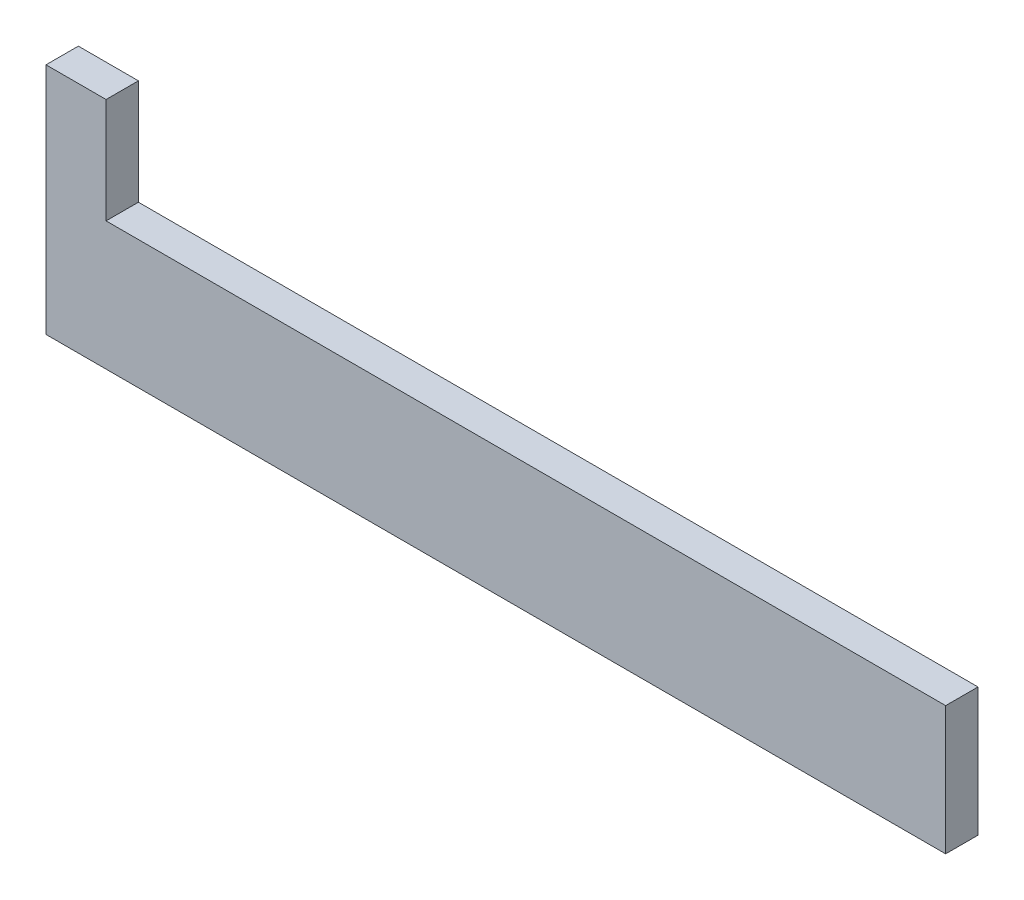
from build123d import *

# Parameters (mm, degrees)
BOSS_EXTRUDE1_DEPTH = 2.1536931
CUT_EXTRUDE1_REACH  = 56.318
SKETCH3_W           = 2.1536931
SKETCH3_H           = 7
SKETCH4_W           = 2.1536931
SKETCH4_H           = 8.5489795
BOSS_EXTRUDE2_DEPTH = 3.9


with BuildPart() as part:
    # Sketch1 → Boss-Extrude1 (new body)
    with BuildSketch(Plane.XY):
        Polygon((28, 0), (-28, 0), (-28, 15.5489795), (-24, 15.5489795), (-24, 8.5489795), (24, 8.5489795), (24, 15.5489795), (28, 15.5489795), align=None)
    extrude(amount=BOSS_EXTRUDE1_DEPTH)

    # Sketch3 → Cut-Extrude1 (cut, up to next)
    with BuildSketch(Plane.ZY.offset(-24), mode=Mode.PRIVATE) as cut_extrude1_sk1:
        with Locations((1.07684655, 12.0489795)):
            Rectangle(SKETCH3_W, SKETCH3_H)
    cut_extrude1_tool1 = extrude(cut_extrude1_sk1.sketch, amount=-CUT_EXTRUDE1_REACH, mode=Mode.PRIVATE) & part.part
    add(cut_extrude1_tool1.solids().sort_by_distance((24, 12.048979, 1.076847))[0], mode=Mode.SUBTRACT)

    # Sketch4 → Boss-Extrude2 (add)
    with BuildSketch(Plane(origin=(28, 0, 0), x_dir=(0, 0, -1), z_dir=(1, 0, 0))):
        with Locations((-1.07684655, 4.27448975)):
            Rectangle(SKETCH4_W, SKETCH4_H)
    extrude(amount=BOSS_EXTRUDE2_DEPTH)


solid = part.part
